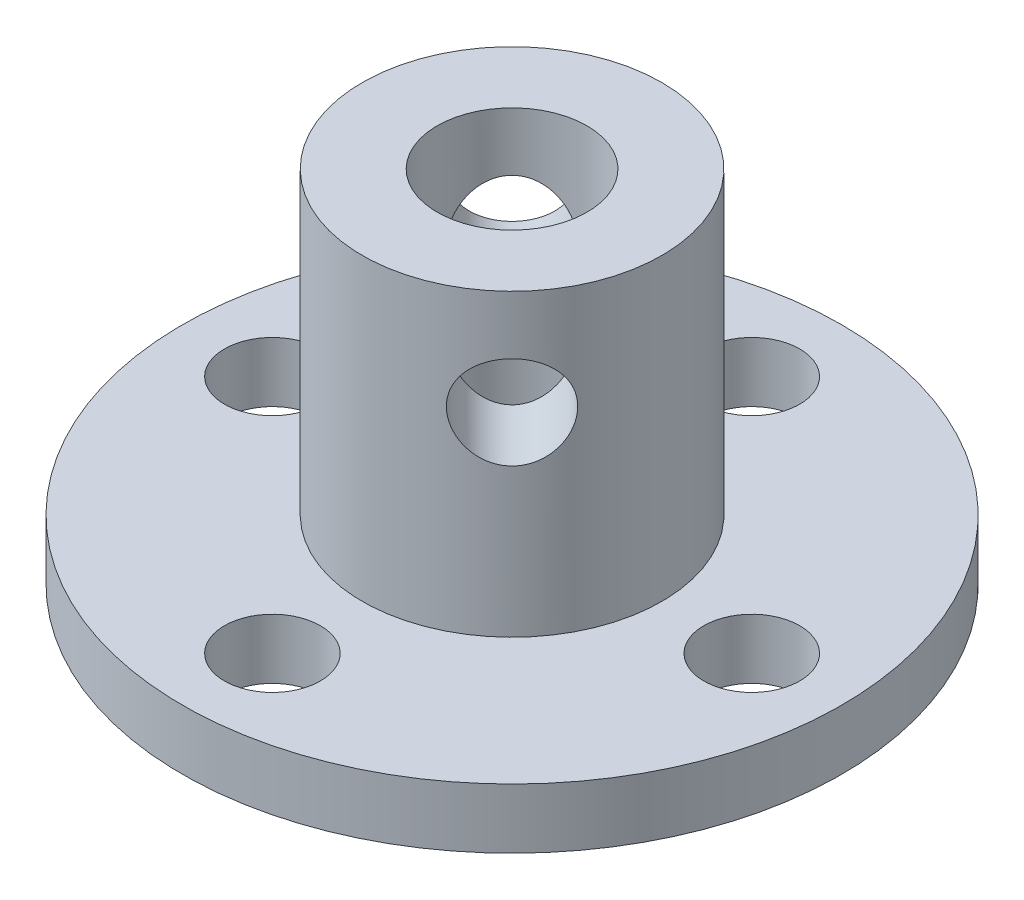
from build123d import *

# Parameters (mm, degrees)
SKETCH_2_R               = 1.6
CUT_EXTRUDE_1_DEPTH      = 10
CUT_EXTRUDE_2_DEPTH      = 10
CUT_EXTRUDE_2_DEPTH_BACK = 10
SKETCH_3_R               = 1.55


with BuildPart() as part:
    # 草图1 → 旋转1 (revolve)
    with BuildSketch(Plane.XY):
        Polygon((-2.5, 0.013967073), (-11, 0.013967073), (-11, 2.013967073), (-5, 2.013967073), (-5, 12.013967073), (-2.5, 12.013967073), align=None)
    revolve(axis=Axis((0, 0, 0), (0, 1, 0)))

    # 草图2 → 切除-拉伸1 (cut)
    with BuildSketch(Plane.XZ.offset(-0.013967073)):
        with Locations((-8, 0)):
            Circle(SKETCH_2_R)
        with Locations((0, 8)):
            Circle(SKETCH_2_R)
        with Locations((8, 0)):
            Circle(SKETCH_2_R)
        with Locations((0, -8)):
            Circle(SKETCH_2_R)
    extrude(amount=-CUT_EXTRUDE_1_DEPTH, mode=Mode.SUBTRACT)

    # 草图3 → 切除-拉伸2 (cut, two sides: drawn at the far end of the back side and taken through both)
    with BuildSketch(Plane(origin=(0, 0, 0), x_dir=(0, -1, 0), z_dir=(0.7071067811865464, 0, 0.7071067811865488)).offset(-CUT_EXTRUDE_2_DEPTH_BACK)):
        with Locations((-8.513967073, 0)):
            Circle(SKETCH_3_R)
    extrude(amount=CUT_EXTRUDE_2_DEPTH + CUT_EXTRUDE_2_DEPTH_BACK, mode=Mode.SUBTRACT)


solid = part.part
